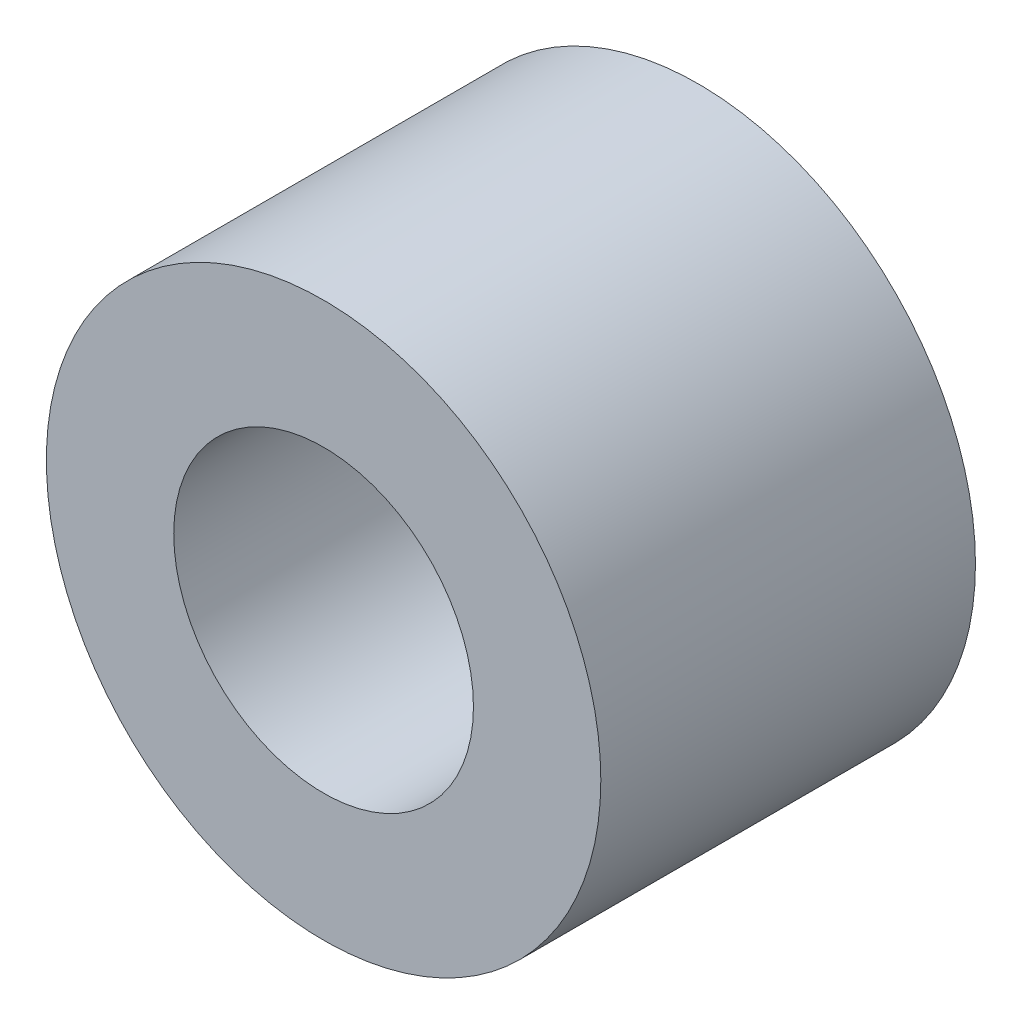
from build123d import *

# Parameters (mm, degrees)
SKETCH_1_R          = 3.7
EXTRUDE_1_DEPTH     = 5
SKETCH_2_R          = 2
CUT_EXTRUDE_1_DEPTH = 3
CUT_EXTRUDE_2_DEPTH = 4


with BuildPart() as part:
    # 草图1 → 凸台-拉伸1 (new body)
    with BuildSketch(Plane.XY):
        Circle(SKETCH_1_R)
    extrude(amount=EXTRUDE_1_DEPTH)

    # 草图2 → 切除-拉伸1 (cut)
    with BuildSketch(Plane.XY.offset(5)):
        Circle(SKETCH_2_R)
    extrude(amount=-CUT_EXTRUDE_1_DEPTH, mode=Mode.SUBTRACT)

    # 草图3 → 切除-拉伸2 (cut)
    with BuildSketch(Plane.XY.offset(2)):
        Polygon((1, -1.732050808), (2, 0), (1, 1.732050808), (-1, 1.732050808), (-2, 0), (-1, -1.732050808), align=None)
    extrude(amount=-CUT_EXTRUDE_2_DEPTH, mode=Mode.SUBTRACT)


solid = part.part
